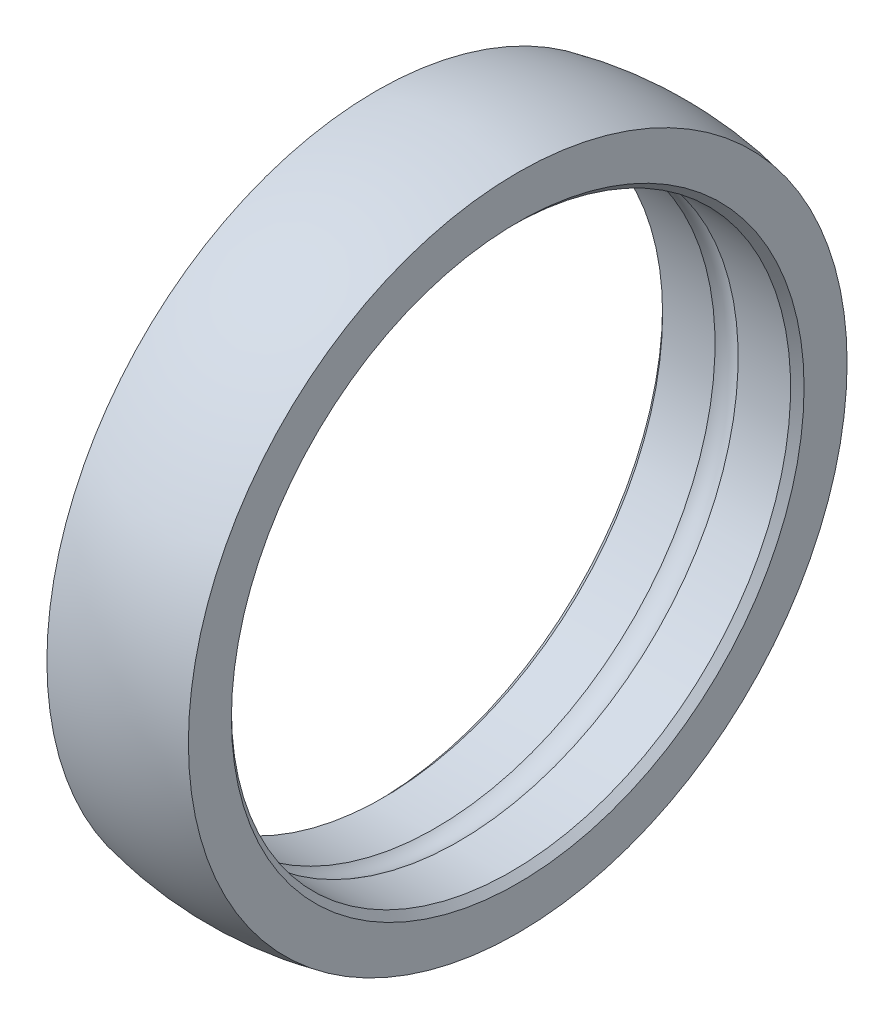
from build123d import *

# Parameters (mm, degrees)
CHAMFER_1_SIZE = 1


with BuildPart() as part:
    # 草图1 → 旋转1 (revolve)
    with BuildSketch(Plane.XY, mode=Mode.PRIVATE) as revolve_1_sk:
        with BuildLine():
            Line((-10.5, 41.5), (-1.717556404, 41.5))
            ThreePointArc((-1.717556404, 41.5), (0, 42), (1.717556404, 41.5))
            Line((1.717556404, 41.5), (10.5, 41.5))
            Line((10.5, 41.5), (10.5, 48.885069295))
            ThreePointArc((10.5, 48.885069295), (0, 50), (-10.5, 48.885069295))
            Line((-10.5, 48.885069295), (-10.5, 41.5))
        make_face()
    revolve(revolve_1_sk.sketch.rotate(Axis((-55.270843916, 0, 0), (1, 0, 0)), 90), axis=Axis((-55.270843916, 0, 0), (1, 0, 0)))

    # 倒角1
    chamfer_1_edges = [part.edges().sort_by_distance(p)[0] for p in [
        (10.5, 0, -41.5),
        (-10.5, 0, -41.5),
    ]]
    chamfer(chamfer_1_edges, length=CHAMFER_1_SIZE)


solid = part.part
